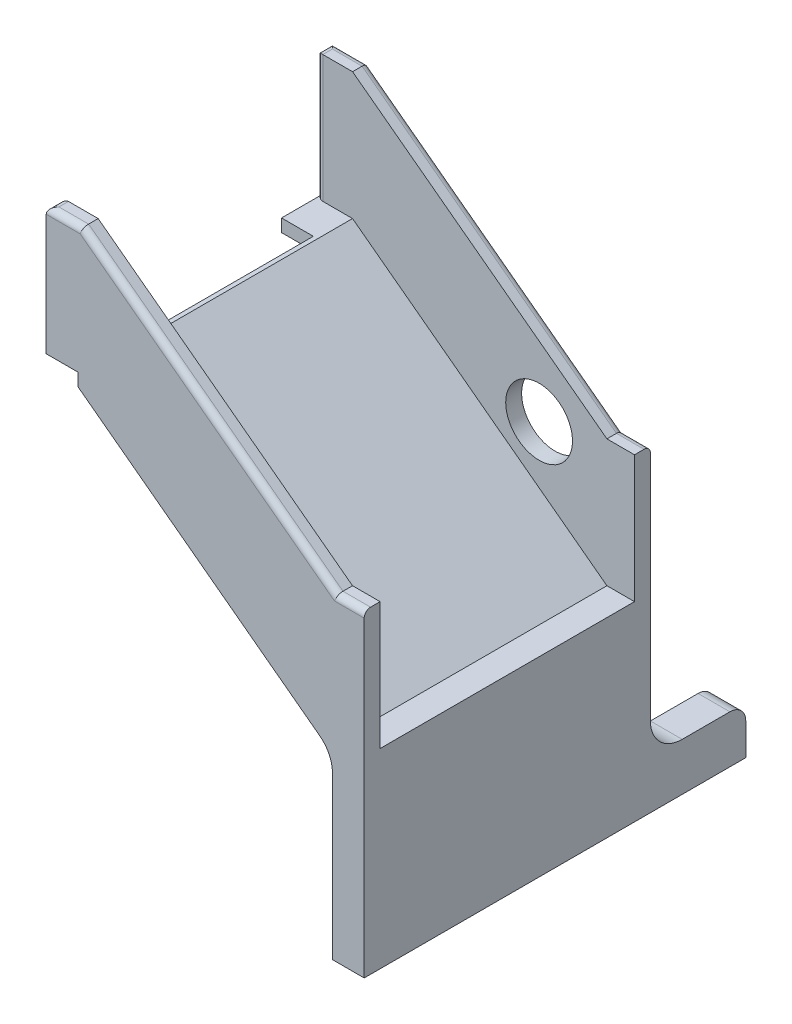
from build123d import *

# Parameters (mm, degrees)
BOSS_EXTRUDE1_DEPTH = 45
BOSS_EXTRUDE2_DEPTH = 5
CUT_EXTRUDE1_REACH  = 148.924
SKETCH3_R           = 10.5
SKETCH8_W           = 10
SKETCH8_H           = 56
BOSS_EXTRUDE4_DEPTH = 90
FILLET2_R           = 10
FILLET3_R           = 2
SKETCH9_W           = 10
SKETCH9_H           = 4
CUT_EXTRUDE2_DEPTH  = 74
SKETCH10_W          = 15
SKETCH10_H          = 35
SKETCH10_R          = 2.9
BOSS_EXTRUDE5_DEPTH = 5
SKETCH11_W          = 10
SKETCH11_H          = 15
BOSS_EXTRUDE6_DEPTH = 30
FILLET4_R           = 10
FILLET5_R           = 5


with BuildPart() as part:
    # Sketch1 → Boss-Extrude1 (new, symmetric)
    with BuildSketch(Plane.XY):
        Polygon((41.677960524, 0), (-38.322039476, 60), (-48.322039476, 60), (-48.322039476, 64), (-36.988706143, 64), (43.011293857, 4), (51.677960524, 4), (51.677960524, 0), align=None)
    extrude(amount=BOSS_EXTRUDE1_DEPTH, both=True)

    # Sketch2 → Boss-Extrude2 (add)
    with BuildSketch(Plane.XY.offset(45)):
        Polygon((-48.322039476, 64), (-48.322039476, 104), (-36.988706143, 104), (43.011293857, 44), (51.677960524, 44), (51.677960524, 4), (43.011293857, 4), (-36.988706143, 64), align=None)
    boss_extrude2 = extrude(amount=-BOSS_EXTRUDE2_DEPTH)

    # Mirror1: Boss-Extrude2 across plane
    add(boss_extrude2.mirror(Plane.XY))

    # Sketch3 → Cut-Extrude1 (cut, up to next)
    with BuildSketch(Plane(origin=(0, 0, -45), x_dir=(-1, 0, 0), z_dir=(0, 0, -1)), mode=Mode.PRIVATE) as cut_extrude1_sk1:
        with Locations((-21.677960524, 38)):
            Circle(SKETCH3_R)
    cut_extrude1_tool1 = extrude(cut_extrude1_sk1.sketch, amount=-CUT_EXTRUDE1_REACH, mode=Mode.PRIVATE) & part.part
    add(cut_extrude1_tool1.solids().sort_by_distance((21.677961, 38, -45))[0], mode=Mode.SUBTRACT)

    # Sketch8 → Boss-Extrude4 (add)
    with BuildSketch(Plane.XY.offset(45)):
        with Locations((46.677960524, -28)):
            Rectangle(SKETCH8_W, SKETCH8_H)
    extrude(amount=-BOSS_EXTRUDE4_DEPTH)

    # Fillet2
    fillet2_edges = [part.edges().sort_by_distance(p)[0] for p in [
        (41.677960524, 0, 0),
    ]]
    fillet(fillet2_edges, radius=FILLET2_R)

    # Fillet3
    fillet3_edges = [part.edges().sort_by_distance(p)[0] for p in [
        (-48.322039476, 84, 40),
        (-48.322039476, 104, 42.5),
        (47.344627191, 44, 45),
        (3.011293857, 74, 45),
        (-42.655372809, 104, 45),
        (47.344627191, 44, -45),
        (3.011293857, 74, -45),
        (-42.655372809, 104, -45),
        (-48.322039476, 104, -42.5),
        (-48.322039476, 84, -40),
    ]]
    fillet(fillet3_edges, radius=FILLET3_R)

    # Sketch9 → Cut-Extrude2 (cut)
    with BuildSketch(Plane.XY.offset(45)):
        with Locations((-43.322039476, 62)):
            Rectangle(SKETCH9_W, SKETCH9_H)
    extrude(amount=-CUT_EXTRUDE2_DEPTH, mode=Mode.SUBTRACT)

    # Sketch11 → Boss-Extrude6 (add)
    with BuildSketch(Plane(origin=(0, 0, -45), x_dir=(-1, 0, 0), z_dir=(0, 0, -1))):
        with Locations((-46.677960524, -48.5)):
            Rectangle(SKETCH11_W, SKETCH11_H)
    extrude(amount=BOSS_EXTRUDE6_DEPTH)

    # Fillet4
    fillet4_edges = [part.edges().sort_by_distance(p)[0] for p in [
        (46.677960524, -41, -45),
    ]]
    fillet(fillet4_edges, radius=FILLET4_R)

    # Fillet5
    fillet5_edges = [part.edges().sort_by_distance(p)[0] for p in [
        (46.677960524, -41, -75),
    ]]
    fillet(fillet5_edges, radius=FILLET5_R)


with BuildPart() as body_2:
    # Sketch10 → Boss-Extrude5 (new body)
    with BuildSketch(Plane.ZY.offset(38.322039476)):
        with Locations((6.08, 42.5)):
            Rectangle(SKETCH10_W, SKETCH10_H)
        with Locations((6.08, 44)):
            Circle(SKETCH10_R, mode=Mode.SUBTRACT)
    extrude(amount=-BOSS_EXTRUDE5_DEPTH)


solid = Compound([part.part, body_2.part])
